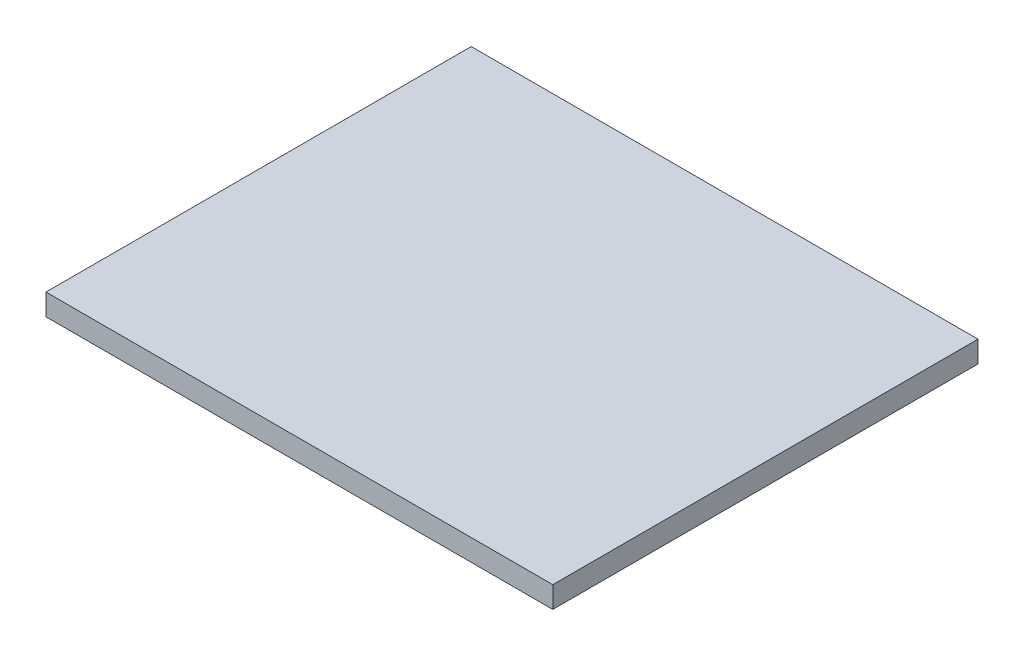
from build123d import *

# Parameters (mm, degrees)
SKETCH1_W           = 59
SKETCH1_H           = 49.5
SKETCH1_R           = 3
BOSS_EXTRUDE1_DEPTH = 1.5
BOSS_EXTRUDE2_DEPTH = 49.5
CUT_EXTRUDE1_DEPTH  = 2
CUT_EXTRUDE3_DEPTH  = 65.105869466
CHAMFER3_SIZE       = 1.5
SKETCH7_W           = 59
SKETCH7_H           = 2.086537977
CUT_EXTRUDE5_DEPTH  = 58.762444547


with BuildPart() as part:
    # Sketch1 → Boss-Extrude1 (new body)
    with BuildSketch(Plane(origin=(0, 0, 0), x_dir=(1, 0, 0), z_dir=(0, 1, 0))):
        Rectangle(SKETCH1_W, SKETCH1_H)
        with Locations(Location((0, 0, 0), (0, 0, 270))):
            Circle(SKETCH1_R, mode=Mode.SUBTRACT)
    extrude(amount=BOSS_EXTRUDE1_DEPTH)

    # Sketch2 → Boss-Extrude2 (add)
    with BuildSketch(Plane(origin=(0, 0, -24.75), x_dir=(-1, 0, 0), z_dir=(0, 0, -1))):
        Polygon((-29.5, 1.5), (29.5, 1.5), (29.5, 2.5), (28.32, 4), (27.14, 2.5), (25.96, 4), (24.78, 2.5), (23.6, 4), (22.42, 2.5), (21.24, 4), (20.06, 2.5), (18.88, 4), (17.7, 2.5), (16.52, 4), (15.34, 2.5), (14.16, 4), (12.98, 2.5), (11.8, 4), (10.62, 2.5), (9.44, 4), (8.26, 2.5), (7.08, 4), (5.9, 2.5), (4.72, 4), (3.54, 2.5), (2.36, 4), (1.18, 2.5), (0, 4), (-1.18, 2.5), (-2.36, 4), (-3.54, 2.5), (-4.72, 4), (-5.9, 2.5), (-7.08, 4), (-8.26, 2.5), (-9.44, 4), (-10.62, 2.5), (-11.8, 4), (-12.98, 2.5), (-14.16, 4), (-15.34, 2.5), (-16.52, 4), (-17.7, 2.5), (-18.88, 4), (-20.06, 2.5), (-21.24, 4), (-22.42, 2.5), (-23.6, 4), (-24.78, 2.5), (-25.96, 4), (-27.14, 2.5), (-28.32, 4), (-29.5, 2.5), align=None)
    extrude(amount=-BOSS_EXTRUDE2_DEPTH)

    # Sketch3 → Cut-Extrude1 (cut)
    with BuildSketch(Plane(origin=(0, 0, 0), x_dir=(-1, 0, 0), z_dir=(0, -1, 0))):
        with BuildLine():
            Line((-1.75, -2.436698586), (-1.75, -5))
            Line((-1.75, -5), (1.75, -5))
            Line((1.75, -5), (1.75, -2.436698586))
            ThreePointArc((1.75, -2.436698586), (0, 3), (-1.75, -2.436698586))
        make_face()
    extrude(amount=-CUT_EXTRUDE1_DEPTH, mode=Mode.SUBTRACT)

    # Sketch4 → Cut-Extrude3 (cut, through all)
    with BuildSketch(Plane(origin=(29.5, 0, 0), x_dir=(0, 0, -1), z_dir=(1, 0, 0))):
        with BuildLine():
            Line((-24, 4), (-24.75, 4))
            Line((-24.75, 4), (-24.75, 3.25))
            ThreePointArc((-24.75, 3.25), (-24.530330086, 3.780330086), (-24, 4))
        make_face()
    cut_extrude3 = extrude(amount=-CUT_EXTRUDE3_DEPTH, mode=Mode.SUBTRACT)

    # Mirror1: Cut-Extrude3 across plane
    add(cut_extrude3.mirror(Plane.XY), mode=Mode.SUBTRACT)

    # Chamfer3
    chamfer3_edges = [part.edges().sort_by_distance(p)[0] for p in [
        (0, 0, 5),
    ]]
    chamfer(chamfer3_edges, length=CHAMFER3_SIZE)

    # Sketch7 → Cut-Extrude5 (cut, through all)
    with BuildSketch(Plane.XY.offset(24.75)):
        with Locations((0, 3.543268988)):
            Rectangle(SKETCH7_W, SKETCH7_H)
    extrude(amount=-CUT_EXTRUDE5_DEPTH, mode=Mode.SUBTRACT)


solid = part.part
